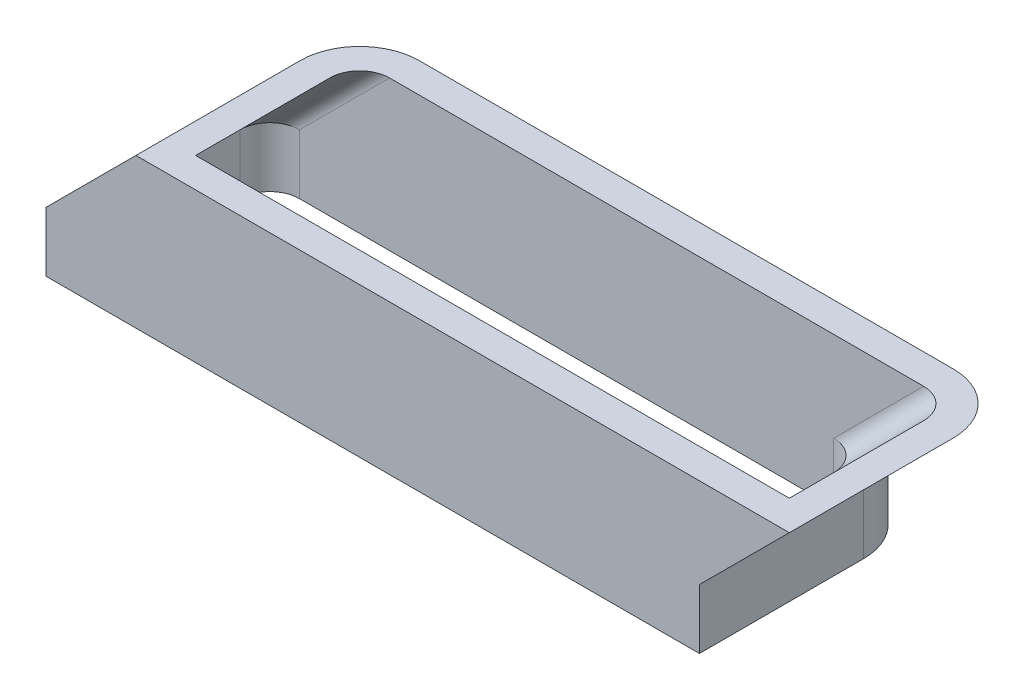
from build123d import *

# Parameters (mm, degrees)
EXTRUDE_2_DEPTH = 2


with BuildPart() as part:
    # По траектории1: sweep along a path in Эскиз2
    with BuildLine(Plane.XY) as sweep_1_path:
        Line((-13.420763014, 0), (-10.40702754, 3.013735474))
    # Эскиз1 → По траектории1 (sweep)
    with BuildSketch(Plane(origin=(0, 0, 0), x_dir=(1, 0, 0), z_dir=(0, 1, 0))):
        with BuildLine():
            Line((-11.420763014, 2.209655172), (6.479236986, 2.209655172))
            ThreePointArc((6.479236986, 2.209655172), (7.893450549, 1.623868735), (8.479236986, 0.209655172))
            Line((8.479236986, 0.209655172), (8.479236986, -5.290344828))
            Line((8.479236986, -5.290344828), (-13.420763014, -5.290344828))
            Line((-13.420763014, -5.290344828), (-13.420763014, 0.209655172))
            ThreePointArc((-13.420763014, 0.209655172), (-12.834976576, 1.623868735), (-11.420763014, 2.209655172))
        make_face()
        with BuildLine():
            Line((-11.420763014, 1.209655172), (6.479236986, 1.209655172))
            ThreePointArc((6.479236986, 1.209655172), (7.186343768, 0.916761954), (7.479236986, 0.209655172))
            Line((7.479236986, 0.209655172), (7.479236986, -4.290344828))
            Line((7.479236986, -4.290344828), (-12.420763014, -4.290344828))
            Line((-12.420763014, -4.290344828), (-12.420763014, 0.209655172))
            ThreePointArc((-12.420763014, 0.209655172), (-12.127869795, 0.916761954), (-11.420763014, 1.209655172))
        make_face(mode=Mode.SUBTRACT)
    sweep(path=sweep_1_path.line)

    # Эскиз3 → Бобышка-Вытянуть2 (add)
    with BuildSketch(Plane.XZ):
        with BuildLine():
            Line((8.479236986, -0.209655172), (8.479236986, 5.290344828))
            Line((8.479236986, 5.290344828), (-13.420763014, 5.290344828))
            Line((-13.420763014, 5.290344828), (-13.420763014, -0.209655172))
            ThreePointArc((-13.420763014, -0.209655172), (-12.834976576, -1.623868735), (-11.420763014, -2.209655172))
            Line((-11.420763014, -2.209655172), (6.479236986, -2.209655172))
            ThreePointArc((6.479236986, -2.209655172), (7.893450549, -1.623868735), (8.479236986, -0.209655172))
        make_face()
        with BuildLine():
            Line((7.479236986, -0.209655172), (7.479236986, 4.290344828))
            Line((7.479236986, 4.290344828), (-12.420763014, 4.290344828))
            Line((-12.420763014, 4.290344828), (-12.420763014, -0.209655172))
            ThreePointArc((-12.420763014, -0.209655172), (-12.127869795, -0.916761954), (-11.420763014, -1.209655172))
            Line((-11.420763014, -1.209655172), (6.479236986, -1.209655172))
            ThreePointArc((6.479236986, -1.209655172), (7.186343768, -0.916761954), (7.479236986, -0.209655172))
        make_face(mode=Mode.SUBTRACT)
    extrude(amount=EXTRUDE_2_DEPTH)


solid = part.part
